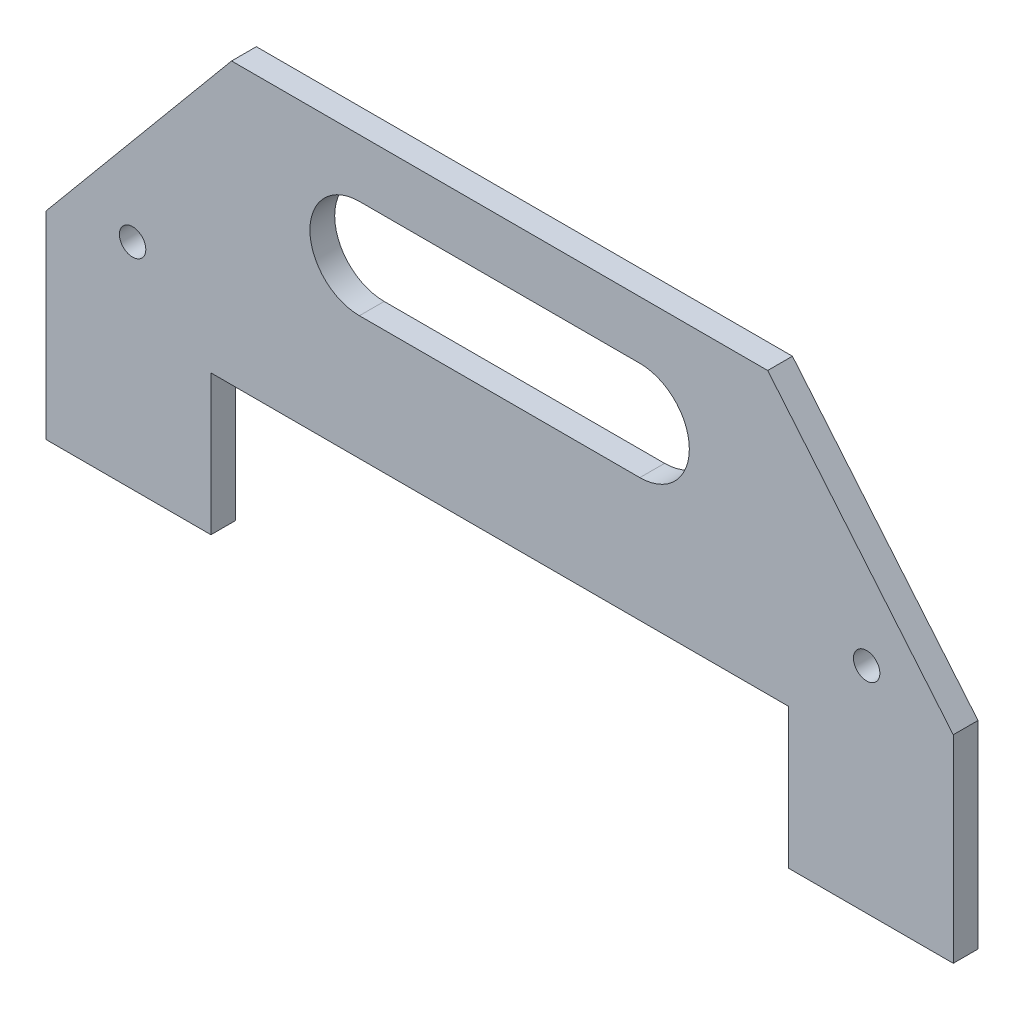
from build123d import *

# Parameters (mm, degrees)
SALIENTE_EXTRUIR1_DEPTH          = 3
TALADRO_DE_MARGEN_PARA_M31_D     = 3.2
TALADRO_DE_MARGEN_PARA_M31_DEPTH = 5
TALADRO_DE_MARGEN_PARA_M31_TIP   = 0.96137699
CORTAR_EXTRUIR1_REACH            = 77.067
CROQUIS4_W                       = 70
CROQUIS4_H                       = 17
CORTAR_EXTRUIR2_REACH            = 77.067


with BuildPart() as part:
    # Croquis1 → Saliente-Extruir1 (new body)
    with BuildSketch(Plane.XY):
        Polygon((-55, 0), (55, 0), (55, 24), (32.5, 51), (-32.5, 51), (-55, 24), align=None)
    extrude(amount=SALIENTE_EXTRUIR1_DEPTH)

    # Taladro de margen para M31
    with Locations(Plane(origin=(44.5, 26, 0), x_dir=(-1, 0, 0), z_dir=(0, 0, -1))):
        with Locations((0, 0), (89, 0)):
            Hole(TALADRO_DE_MARGEN_PARA_M31_D / 2, depth=TALADRO_DE_MARGEN_PARA_M31_DEPTH)
            with Locations((0, 0, -(TALADRO_DE_MARGEN_PARA_M31_DEPTH + TALADRO_DE_MARGEN_PARA_M31_TIP / 2))):  # 118° drill point
                Cone(0, TALADRO_DE_MARGEN_PARA_M31_D / 2, TALADRO_DE_MARGEN_PARA_M31_TIP, mode=Mode.SUBTRACT)

    # Croquis4 → Cortar-Extruir1 (cut, up to next)
    with BuildSketch(Plane.XY.offset(3), mode=Mode.PRIVATE) as cortar_extruir1_sk1:
        with Locations((0, 8.5)):
            Rectangle(CROQUIS4_W, CROQUIS4_H)
    cortar_extruir1_tool1 = extrude(cortar_extruir1_sk1.sketch, amount=-CORTAR_EXTRUIR1_REACH, mode=Mode.PRIVATE) & part.part
    add(cortar_extruir1_tool1.solids().sort_by_distance((0, 8.5, 3))[0], mode=Mode.SUBTRACT)

    # Croquis5 → Cortar-Extruir2 (cut, up to next)
    with BuildSketch(Plane.XY.offset(3), mode=Mode.PRIVATE) as cortar_extruir2_sk1:
        with BuildLine():
            Line((-17, 44), (17, 44))
            ThreePointArc((17, 44), (23, 38), (17, 32))
            Line((17, 32), (-17, 32))
            ThreePointArc((-17, 32), (-23, 38), (-17, 44))
        make_face()
    cortar_extruir2_tool1 = extrude(cortar_extruir2_sk1.sketch, amount=-CORTAR_EXTRUIR2_REACH, mode=Mode.PRIVATE) & part.part
    add(cortar_extruir2_tool1.solids().sort_by_distance((0, 38, 3))[0], mode=Mode.SUBTRACT)


solid = part.part
